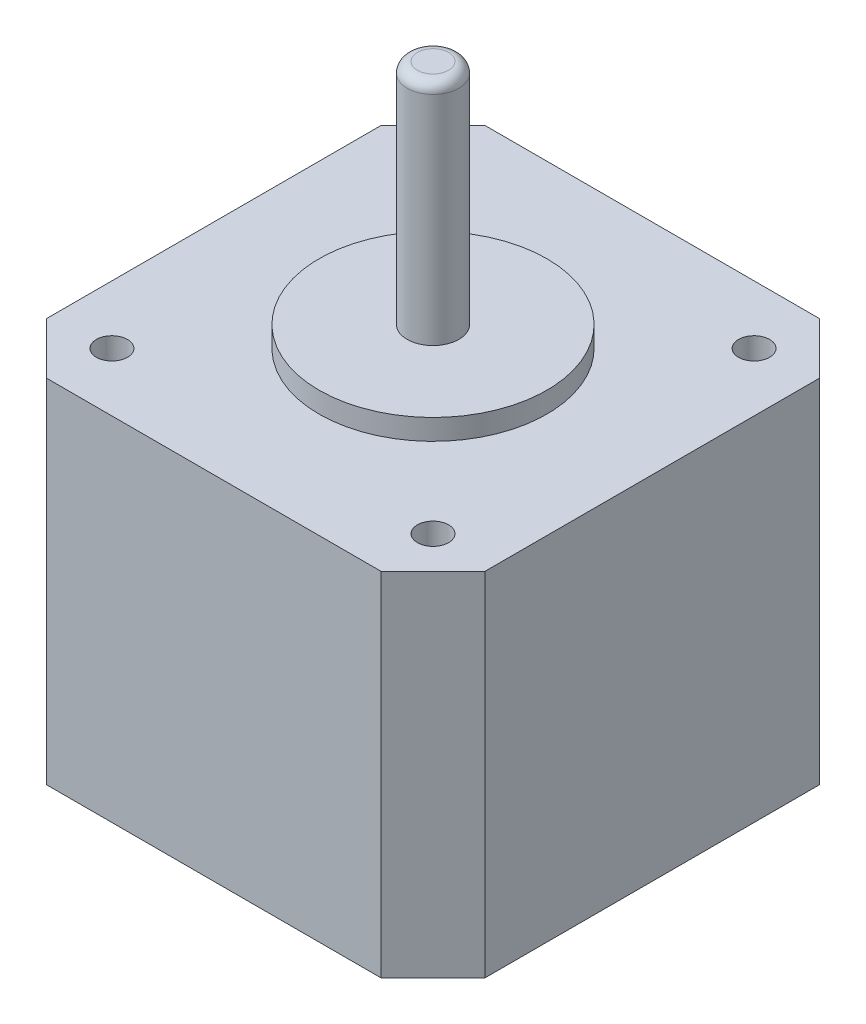
from build123d import *

# Parameters (mm, degrees)
SKETCH1_W           = 42.3
SKETCH1_H           = 42.3
BOSS_EXTRUDE1_DEPTH = 34
SKETCH2_R           = 2.5
BOSS_EXTRUDE2_DEPTH = 24
SKETCH3_R           = 11
BOSS_EXTRUDE3_DEPTH = 2
SKETCH4_R           = 1.5
CUT_EXTRUDE1_DEPTH  = 4.5
CHAMFER1_SIZE       = 5
FILLET1_R           = 1


with BuildPart() as part:
    # Sketch1 → Boss-Extrude1 (new body)
    with BuildSketch(Plane(origin=(0, 0, 0), x_dir=(1, 0, 0), z_dir=(0, 1, 0))):
        Rectangle(SKETCH1_W, SKETCH1_H)
    extrude(amount=BOSS_EXTRUDE1_DEPTH)

    # Sketch2 → Boss-Extrude2 (add)
    with BuildSketch(Plane(origin=(0, 34, 0), x_dir=(1, 0, 0), z_dir=(0, 1, 0))):
        with Locations(Location((0, 0, 0), (0, 0, 90))):
            Circle(SKETCH2_R)
    extrude(amount=BOSS_EXTRUDE2_DEPTH)

    # Sketch3 → Boss-Extrude3 (add)
    with BuildSketch(Plane(origin=(0, 34, 0), x_dir=(1, 0, 0), z_dir=(0, 1, 0))):
        with Locations(Location((0, 0, 0), (0, 0, 90))):
            Circle(SKETCH3_R)
    extrude(amount=BOSS_EXTRUDE3_DEPTH)

    # Sketch4 → Cut-Extrude1 (cut)
    with BuildSketch(Plane(origin=(0, 34, 0), x_dir=(1, 0, 0), z_dir=(0, 1, 0))):
        with Locations(Location((-15.5, 15.5, 0), (0, 0, 270))):
            Circle(SKETCH4_R)
        with Locations(Location((15.5, 15.5, 0), (0, 0, 270))):
            Circle(SKETCH4_R)
        with Locations(Location((15.5, -15.5, 0), (0, 0, 270))):
            Circle(SKETCH4_R)
        with Locations(Location((-15.5, -15.5, 0), (0, 0, 270))):
            Circle(SKETCH4_R)
    extrude(amount=-CUT_EXTRUDE1_DEPTH, mode=Mode.SUBTRACT)

    # Chamfer1
    chamfer1_edges = [part.edges().sort_by_distance(p)[0] for p in [
        (21.15, 17, 21.15),
        (-21.15, 17, 21.15),
        (-21.15, 17, -21.15),
        (21.15, 17, -21.15),
    ]]
    chamfer(chamfer1_edges, length=CHAMFER1_SIZE)

    # Fillet1
    fillet1_edges = [part.edges().sort_by_distance(p)[0] for p in [
        (0, 58, 2.5),
    ]]
    fillet(fillet1_edges, radius=FILLET1_R)


solid = part.part
